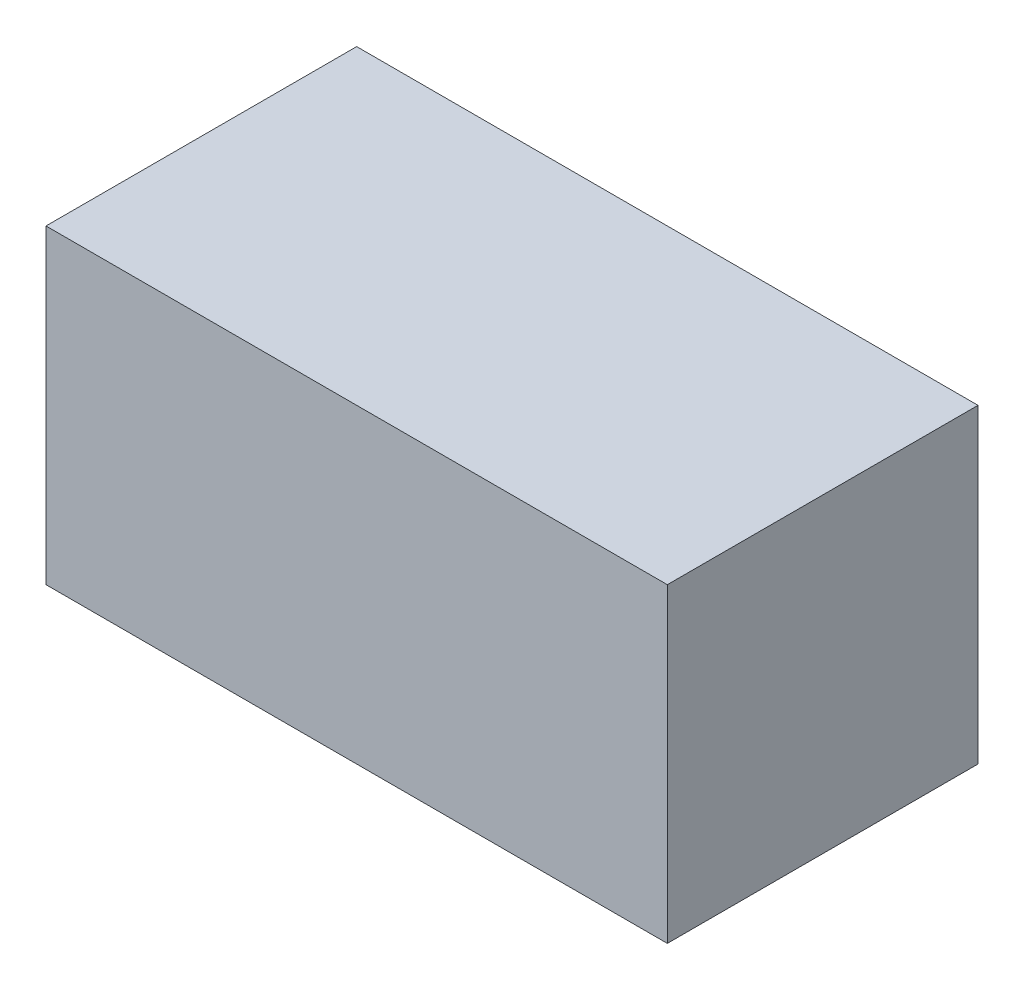
from build123d import *

# Parameters (mm, degrees)
SKETCH1_W           = 20
SKETCH1_H           = 10
BOSS_EXTRUDE1_DEPTH = 10


with BuildPart() as part:
    # Sketch1 → Boss-Extrude1 (new body)
    with BuildSketch(Plane(origin=(0, 0, 0), x_dir=(1, 0, 0), z_dir=(0, 1, 0))):
        with Locations((10, 5)):
            Rectangle(SKETCH1_W, SKETCH1_H)
    extrude(amount=BOSS_EXTRUDE1_DEPTH)


solid = part.part
